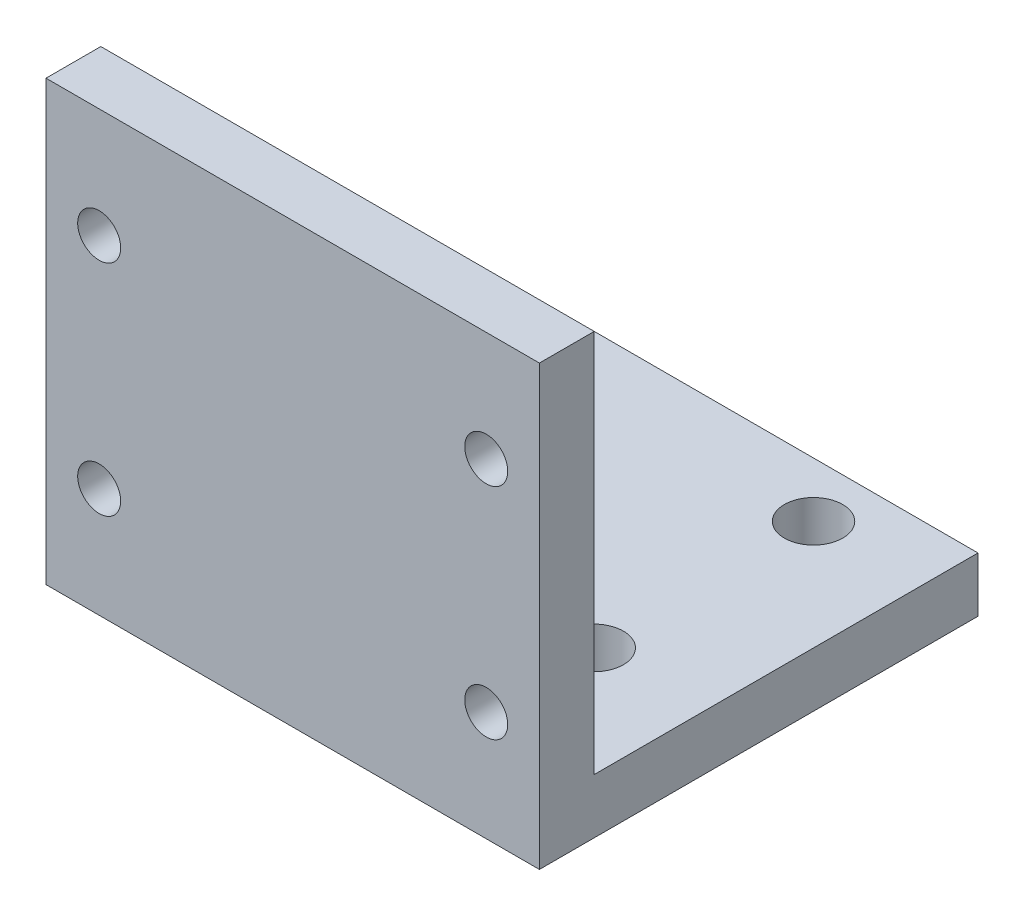
from build123d import *

# Parameters (mm, degrees)
BOSS_EXTRUDE1_DEPTH = 57.15
SKETCH3_R           = 2.4892
CUT_EXTRUDE1_DEPTH  = 92.800885072
SKETCH4_R           = 3.3782
CUT_EXTRUDE2_DEPTH  = 89.44526556


with BuildPart() as part:
    # Sketch1 → Boss-Extrude1 (new body)
    with BuildSketch(Plane(origin=(0, 0, 0), x_dir=(0, 0, -1), z_dir=(1, 0, 0))):
        Polygon((0, 0), (0, 50.8), (6.35, 50.8), (6.35, 6.35), (50.8, 6.35), (50.8, 0), align=None)
    extrude(amount=BOSS_EXTRUDE1_DEPTH)

    # Sketch3 → Cut-Extrude1 (cut, through all)
    with BuildSketch(Plane.XY):
        with Locations((6.1595, 38.1)):
            Circle(SKETCH3_R)
        with Locations((50.9905, 38.1)):
            Circle(SKETCH3_R)
        with Locations((50.9905, 12.7)):
            Circle(SKETCH3_R)
        with Locations((6.1595, 12.7)):
            Circle(SKETCH3_R)
    extrude(amount=-CUT_EXTRUDE1_DEPTH, mode=Mode.SUBTRACT)

    # Sketch4 → Cut-Extrude2 (cut, through all)
    with BuildSketch(Plane(origin=(0, 6.35, 0), x_dir=(1, 0, 0), z_dir=(0, 1, 0))):
        with Locations(Location((12.7, 19.05, 0), (0, 0, 270))):
            Circle(SKETCH4_R)
        with Locations(Location((12.7, 44.45, 0), (0, 0, 270))):
            Circle(SKETCH4_R)
        with Locations(Location((44.45, 44.45, 0), (0, 0, 270))):
            Circle(SKETCH4_R)
        with Locations(Location((44.45, 19.05, 0), (0, 0, 270))):
            Circle(SKETCH4_R)
    extrude(amount=-CUT_EXTRUDE2_DEPTH, mode=Mode.SUBTRACT)


solid = part.part
